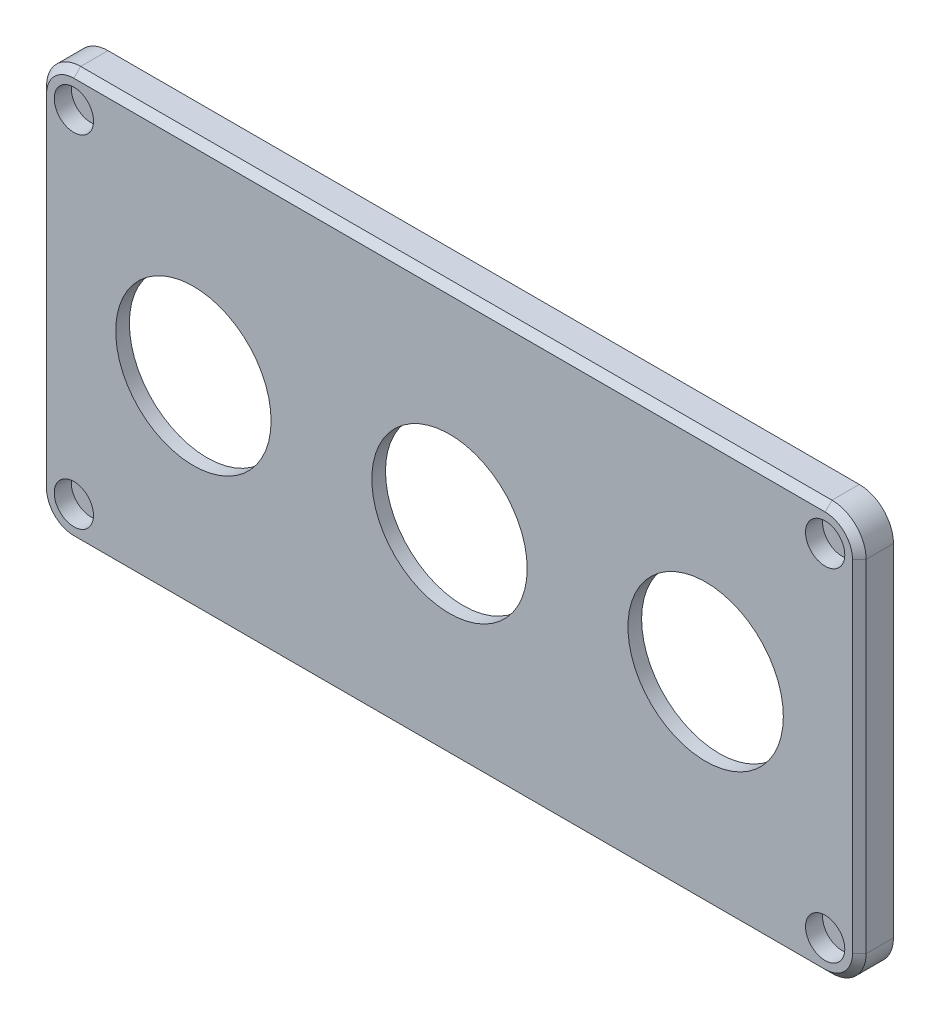
from build123d import *

# Parameters (mm, degrees)
SKETCH1_W           = 120
SKETCH1_H           = 60
BOSS_EXTRUDE1_DEPTH = 5
SKETCH2_R           = 11.375
CUT_EXTRUDE1_DEPTH  = 68.268120235
FILLET1_R           = 5
SKETCH3_R           = 1.5
CUT_EXTRUDE2_DEPTH  = 68.268120235
SKETCH4_R           = 2.875
CUT_EXTRUDE3_DEPTH  = 2.5
CHAMFER1_SIZE       = 1
SKETCH5_R           = 16
CUT_EXTRUDE4_DEPTH  = 3
SKETCH6_R           = 2.5
BOSS_EXTRUDE2_DEPTH = 0.15


with BuildPart() as part:
    # Sketch1 → Boss-Extrude1 (new body)
    with BuildSketch(Plane.XY):
        Rectangle(SKETCH1_W, SKETCH1_H)
    extrude(amount=BOSS_EXTRUDE1_DEPTH)

    # Sketch2 → Cut-Extrude1 (cut, through all)
    with BuildSketch(Plane.XY.offset(5)):
        Circle(SKETCH2_R)
        with Locations((37.5, 0)):
            Circle(SKETCH2_R)
        with Locations((-37.5, 0)):
            Circle(SKETCH2_R)
    extrude(amount=-CUT_EXTRUDE1_DEPTH, mode=Mode.SUBTRACT)

    # Fillet1
    fillet1_edges = [part.edges().sort_by_distance(p)[0] for p in [
        (60, -30, 2.5),
        (-60, -30, 2.5),
        (-60, 30, 2.5),
        (60, 30, 2.5),
    ]]
    fillet(fillet1_edges, radius=FILLET1_R)

    # Sketch3 → Cut-Extrude2 (cut, through all)
    with BuildSketch(Plane.XY.offset(5)):
        with Locations((-55, 25)):
            Circle(SKETCH3_R)
        with Locations((55, 25)):
            Circle(SKETCH3_R)
        with Locations((55, -25)):
            Circle(SKETCH3_R)
        with Locations((-55, -25)):
            Circle(SKETCH3_R)
    extrude(amount=-CUT_EXTRUDE2_DEPTH, mode=Mode.SUBTRACT)

    # Sketch4 → Cut-Extrude3 (cut)
    with BuildSketch(Plane.XY.offset(5)):
        with Locations((-55, 25)):
            Circle(SKETCH4_R)
        with Locations((55, 25)):
            Circle(SKETCH4_R)
        with Locations((55, -25)):
            Circle(SKETCH4_R)
        with Locations((-55, -25)):
            Circle(SKETCH4_R)
    extrude(amount=-CUT_EXTRUDE3_DEPTH, mode=Mode.SUBTRACT)

    # Chamfer1
    chamfer1_edges = [part.edges().sort_by_distance(p)[0] for p in [
        (0, -30, 5),
        (-60, 0, 5),
        (60, 0, 5),
        (0, 30, 5),
        (-58.535533906, 28.535533906, 5),
        (58.535533906, 28.535533906, 5),
        (58.535533906, -28.535533906, 5),
        (-58.535533906, -28.535533906, 5),
    ]]
    chamfer(chamfer1_edges, length=CHAMFER1_SIZE)

    # Sketch5 → Cut-Extrude4 (cut)
    with BuildSketch(Plane(origin=(0, 0, 0), x_dir=(-1, 0, 0), z_dir=(0, 0, -1))):
        with Locations((-37.5, 0)):
            Circle(SKETCH5_R)
        Circle(SKETCH5_R)
        with Locations((37.5, 0)):
            Circle(SKETCH5_R)
    extrude(amount=-CUT_EXTRUDE4_DEPTH, mode=Mode.SUBTRACT)

    # Sketch6 → Boss-Extrude2 (add)
    with BuildSketch(Plane.XY.offset(2.5)):
        with Locations((-55, 25)):
            Circle(SKETCH6_R)
        with Locations((55, 25)):
            Circle(SKETCH6_R)
        with Locations((55, -25)):
            Circle(SKETCH6_R)
        with Locations((-55, -25)):
            Circle(SKETCH6_R)
    extrude(amount=-BOSS_EXTRUDE2_DEPTH)


solid = part.part
